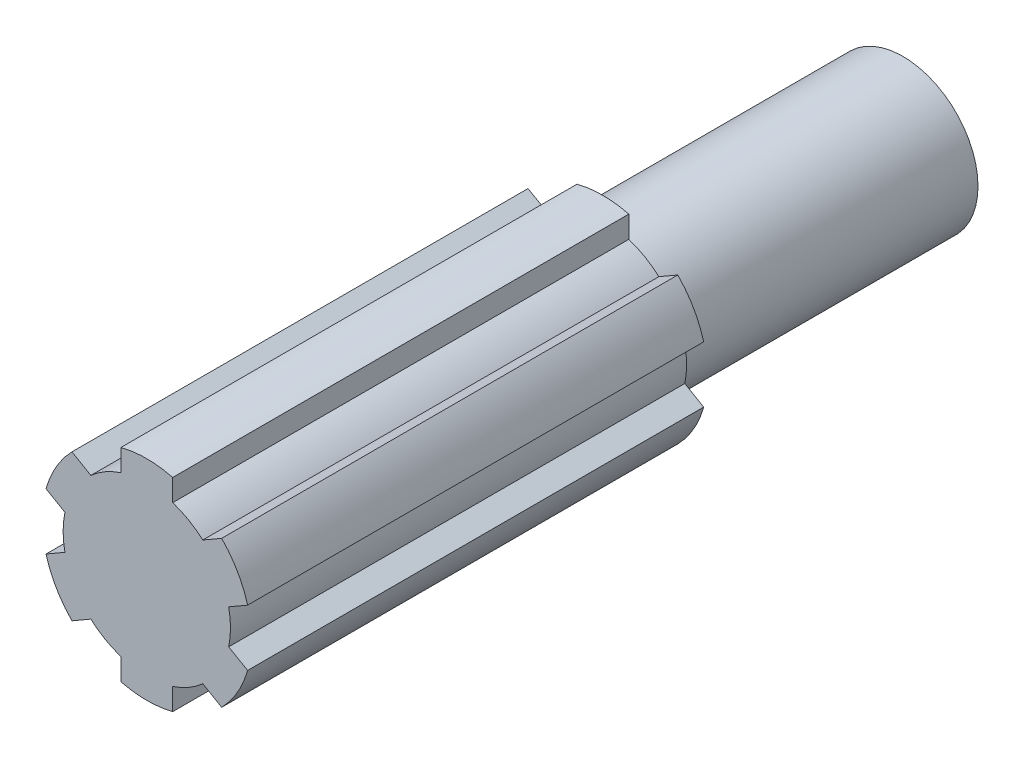
from build123d import *

# Parameters (mm, degrees)
SKETCH1_R           = 12.5
BOSS_EXTRUDE1_DEPTH = 50
BOSS_EXTRUDE2_DEPTH = 76


with BuildPart() as part:
    # Sketch1 → Boss-Extrude1 (new body)
    with BuildSketch(Plane.XY):
        Circle(SKETCH1_R)
    extrude(amount=BOSS_EXTRUDE1_DEPTH)

    # Sketch2 → Boss-Extrude2 (add)
    with BuildSketch(Plane.XY.offset(50)):
        with BuildLine():
            Line((9.322615937, 10.370721146), (12.477254481, 12.192052559))
            ThreePointArc((12.477254481, 12.192052559), (15.107813169, 8.7225), (16.797254481, 4.709593071))
            Line((16.797254481, 4.709593071), (13.642615937, 2.888261658))
            ThreePointArc((13.642615937, 2.888261658), (13.945, 0), (13.642615937, -2.888261658))
            Line((13.642615937, -2.888261658), (16.797254481, -4.709593071))
            ThreePointArc((16.797254481, -4.709593071), (15.107813169, -8.7225), (12.477254481, -12.192052559))
            Line((12.477254481, -12.192052559), (9.322615937, -10.370721146))
            ThreePointArc((9.322615937, -10.370721146), (6.9725, -12.076724256), (4.32, -13.258982804))
            Line((4.32, -13.258982804), (4.32, -16.90164563))
            ThreePointArc((4.32, -16.90164563), (0, -17.445), (-4.32, -16.90164563))
            Line((-4.32, -16.90164563), (-4.32, -13.258982804))
            ThreePointArc((-4.32, -13.258982804), (-6.9725, -12.076724256), (-9.322615937, -10.370721146))
            Line((-9.322615937, -10.370721146), (-12.477254481, -12.192052559))
            ThreePointArc((-12.477254481, -12.192052559), (-15.107813169, -8.7225), (-16.797254481, -4.709593071))
            Line((-16.797254481, -4.709593071), (-13.642615937, -2.888261658))
            ThreePointArc((-13.642615937, -2.888261658), (-13.945, 0), (-13.642615937, 2.888261658))
            Line((-13.642615937, 2.888261658), (-16.797254481, 4.709593071))
            ThreePointArc((-16.797254481, 4.709593071), (-15.107813169, 8.7225), (-12.477254481, 12.192052559))
            Line((-12.477254481, 12.192052559), (-9.322615937, 10.370721146))
            ThreePointArc((-9.322615937, 10.370721146), (-6.9725, 12.076724256), (-4.32, 13.258982804))
            Line((-4.32, 13.258982804), (-4.32, 16.90164563))
            ThreePointArc((-4.32, 16.90164563), (0, 17.445), (4.32, 16.90164563))
            Line((4.32, 16.90164563), (4.32, 13.258982804))
            ThreePointArc((4.32, 13.258982804), (6.9725, 12.076724256), (9.322615937, 10.370721146))
        make_face()
    extrude(amount=BOSS_EXTRUDE2_DEPTH)


solid = part.part
